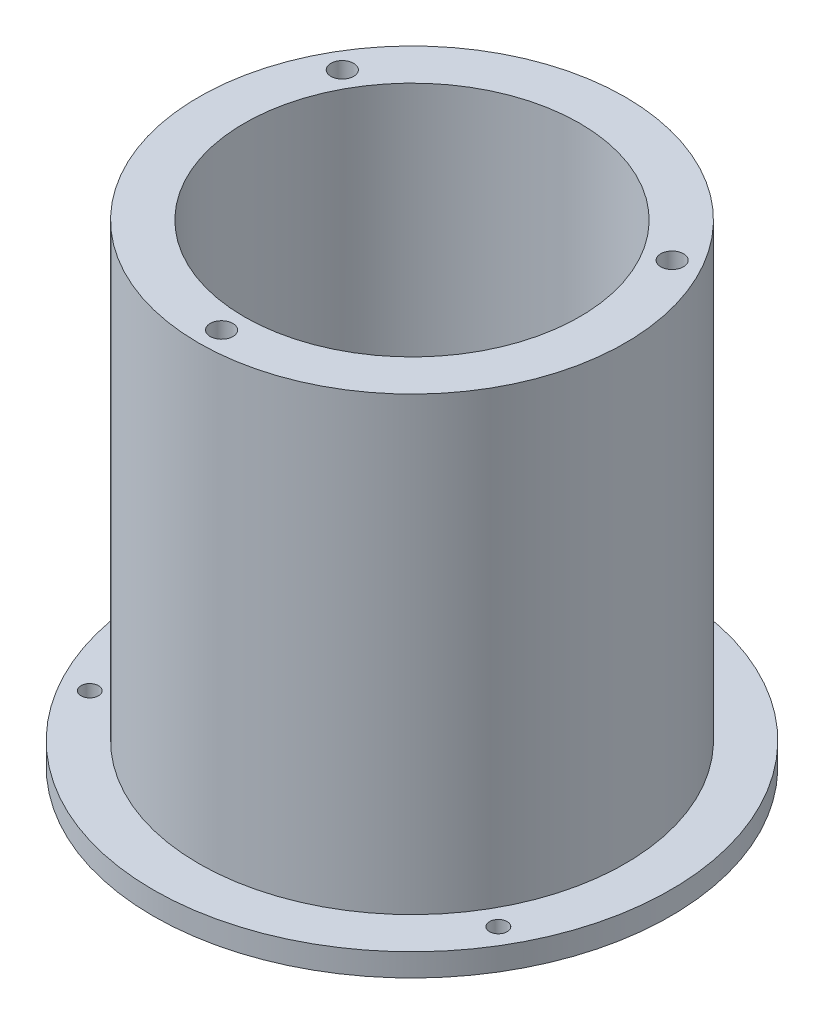
from build123d import *

# Parameters (mm, degrees)
SKETCH1_R           = 45.5
SKETCH1_R_2         = 29.5
BOSS_EXTRUDE1_DEPTH = 4
SKETCH2_R           = 37.5
SKETCH2_R_2         = 29.5
BOSS_EXTRUDE2_DEPTH = 79.3
SKETCH4_R           = 1.55
CUT_EXTRUDE1_DEPTH  = 83.3
CIRPATTERN1_COUNT   = 3
SKETCH6_R           = 2
CUT_EXTRUDE2_DEPTH  = 6
CIRPATTERN2_COUNT   = 3
SKETCH8_R           = 30.5
CUT_EXTRUDE4_DEPTH  = 6


with BuildPart() as part:
    # Sketch1 → Boss-Extrude1 (new body)
    with BuildSketch(Plane(origin=(0, 0, 0), x_dir=(1, 0, 0), z_dir=(0, 1, 0))):
        with Locations(Location((0, 0, 0), (0, 0, 270))):
            Circle(SKETCH1_R)
        with Locations(Location((0, 0, 0), (0, 0, 270))):
            Circle(SKETCH1_R_2, mode=Mode.SUBTRACT)
    extrude(amount=BOSS_EXTRUDE1_DEPTH)

    # Sketch2 → Boss-Extrude2 (add)
    with BuildSketch(Plane(origin=(0, 4, 0), x_dir=(1, 0, 0), z_dir=(0, 1, 0))):
        with Locations(Location((0, 0, 0), (0, 0, 270))):
            Circle(SKETCH2_R)
        with Locations(Location((0, 0, 0), (0, 0, 270))):
            Circle(SKETCH2_R_2, mode=Mode.SUBTRACT)
    extrude(amount=BOSS_EXTRUDE2_DEPTH)

    # Sketch4 → Cut-Extrude1 (cut)
    with BuildSketch(Plane(origin=(0, 4, 0), x_dir=(1, 0, 0), z_dir=(0, 1, 0))):
        with Locations(Location((0, 41.5, 0), (0, 0, 270))):
            Circle(SKETCH4_R)
    cut_extrude1 = extrude(amount=-CUT_EXTRUDE1_DEPTH, mode=Mode.SUBTRACT)

    # CirPattern1: Cut-Extrude1 ×3 about axis
    cirpattern1_axis = Axis((0, 0, 0), (0, 1, 0))
    for i in range(1, CIRPATTERN1_COUNT):
        add(cut_extrude1.rotate(cirpattern1_axis, i * 360 / CIRPATTERN1_COUNT), mode=Mode.SUBTRACT)

    # Sketch6 → Cut-Extrude2 (cut)
    with BuildSketch(Plane(origin=(0, 83.3, 0), x_dir=(1, 0, 0), z_dir=(0, 1, 0))):
        with Locations(Location((-29.011851027, 16.75, 0), (0, 0, 270))):
            Circle(SKETCH6_R)
    cut_extrude2 = extrude(amount=-CUT_EXTRUDE2_DEPTH, mode=Mode.SUBTRACT)

    # CirPattern2: Cut-Extrude2 ×3 about axis
    cirpattern2_axis = Axis((0, 0, 0), (0, 1, 0))
    for i in range(1, CIRPATTERN2_COUNT):
        add(cut_extrude2.rotate(cirpattern2_axis, i * 360 / CIRPATTERN2_COUNT), mode=Mode.SUBTRACT)

    # Sketch8 → Cut-Extrude4 (cut)
    with BuildSketch(Plane.XZ):
        with Locations(Location((0, 0, 0), (0, 0, 270))):
            Circle(SKETCH8_R)
    extrude(amount=-CUT_EXTRUDE4_DEPTH, mode=Mode.SUBTRACT)


solid = part.part
